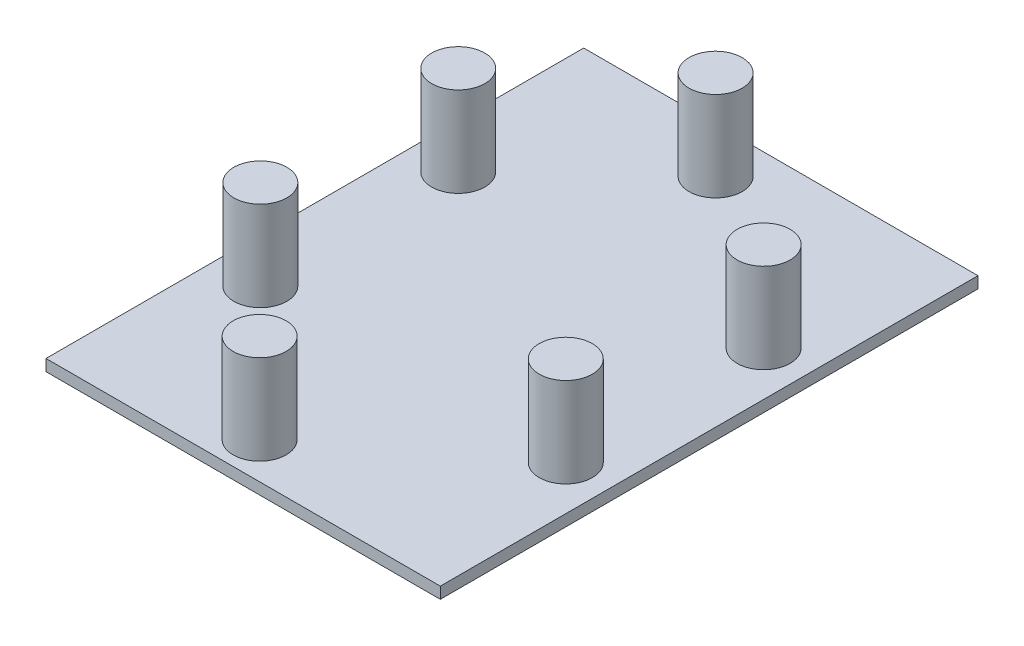
from build123d import *

# Parameters (mm, degrees)
SKETCH1_W           = 55
SKETCH1_H           = 75
BOSS_EXTRUDE1_DEPTH = 1.6
SKETCH2_R           = 3.7
BOSS_EXTRUDE2_DEPTH = 12.5


with BuildPart() as part:
    # Sketch1 → Boss-Extrude1 (new body)
    with BuildSketch(Plane(origin=(0, 0, 0), x_dir=(1, 0, 0), z_dir=(0, 1, 0))):
        Rectangle(SKETCH1_W, SKETCH1_H)
    extrude(amount=BOSS_EXTRUDE1_DEPTH)

    # Sketch2 → Boss-Extrude2 (add)
    with BuildSketch(Plane(origin=(0, 1.6, 0), x_dir=(1, 0, 0), z_dir=(0, 1, 0))):
        with Locations(Location((-2.8, -32.4, 0), (0, 0, 270))):
            Circle(SKETCH2_R)
        with Locations(Location((-21.3, -13.8, 0), (0, 0, 270))):
            Circle(SKETCH2_R)
        with Locations(Location((-21.3, 13.8, 0), (0, 0, 270))):
            Circle(SKETCH2_R)
        with Locations(Location((-2.8, 31.2, 0), (0, 0, 270))):
            Circle(SKETCH2_R)
        with Locations(Location((21.3, 13.8, 0), (0, 0, 270))):
            Circle(SKETCH2_R)
        with Locations(Location((21.3, -13.8, 0), (0, 0, 270))):
            Circle(SKETCH2_R)
    extrude(amount=BOSS_EXTRUDE2_DEPTH)


solid = part.part
